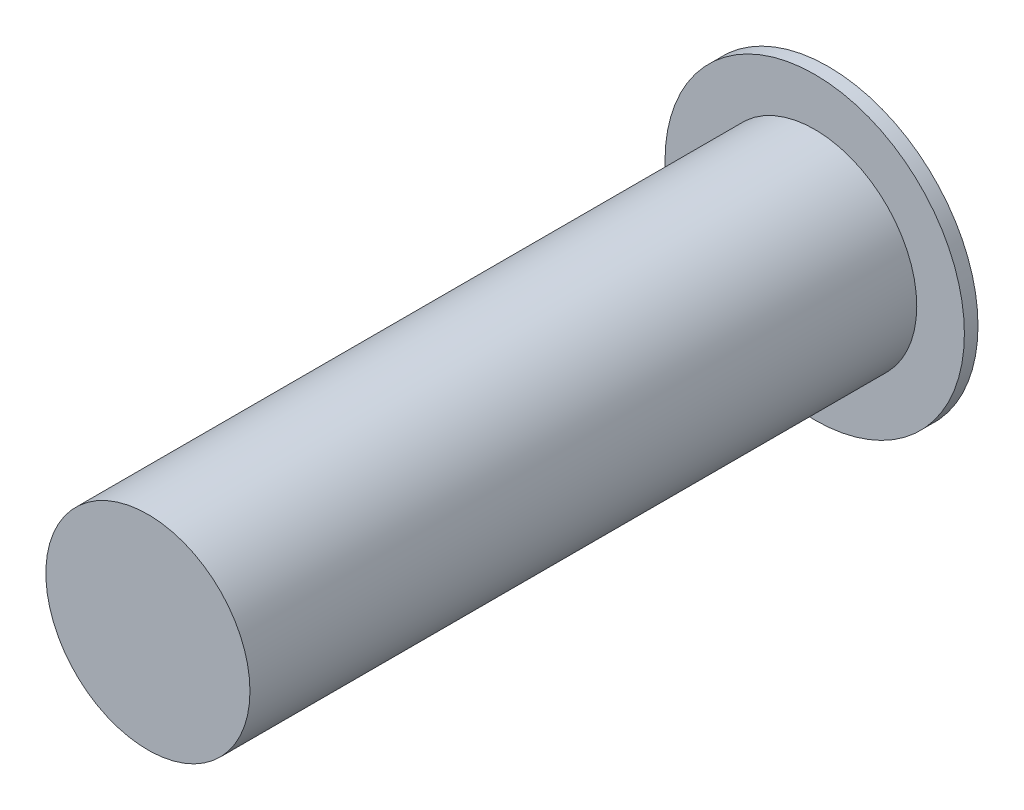
from build123d import *

# Parameters (mm, degrees)
SKETCH1_R           = 22
BOSS_EXTRUDE1_DEPTH = 2
SKETCH2_R           = 15
BOSS_EXTRUDE2_DEPTH = 100


with BuildPart() as part:
    # Sketch1 → Boss-Extrude1 (new body)
    with BuildSketch(Plane.XY):
        Circle(SKETCH1_R)
    extrude(amount=BOSS_EXTRUDE1_DEPTH)

    # Sketch2 → Boss-Extrude2 (add)
    with BuildSketch(Plane.XY):
        Circle(SKETCH2_R)
    extrude(amount=BOSS_EXTRUDE2_DEPTH)


solid = part.part
